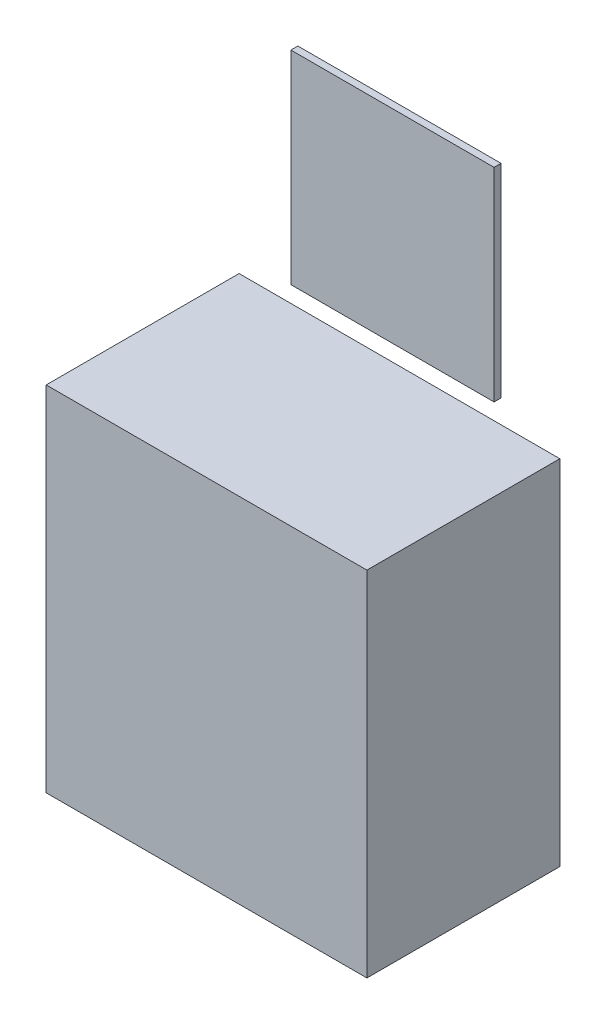
from build123d import *

# Parameters (mm, degrees)
SKETCH2_W           = 1380
SKETCH2_H           = 1520
BOSS_EXTRUDE3_DEPTH = 830
SKETCH3_W           = 874.303729776
SKETCH3_H           = 874.295
BOSS_EXTRUDE6_DEPTH = 30


with BuildPart() as part:
    # Sketch2 → Boss-Extrude3 (new body)
    with BuildSketch(Plane.XY):
        with Locations((23.262557024, 22.44080113)):
            Rectangle(SKETCH2_W, SKETCH2_H)
    extrude(amount=BOSS_EXTRUDE3_DEPTH)


with BuildPart() as body_2:
    # Sketch3 → Boss-Extrude6 (new body)
    with BuildSketch(Plane.XY):
        with Locations((23.262557024, 1319.58830113)):
            Rectangle(SKETCH3_W, SKETCH3_H)
    extrude(amount=BOSS_EXTRUDE6_DEPTH)


solid = Compound([part.part, body_2.part])
